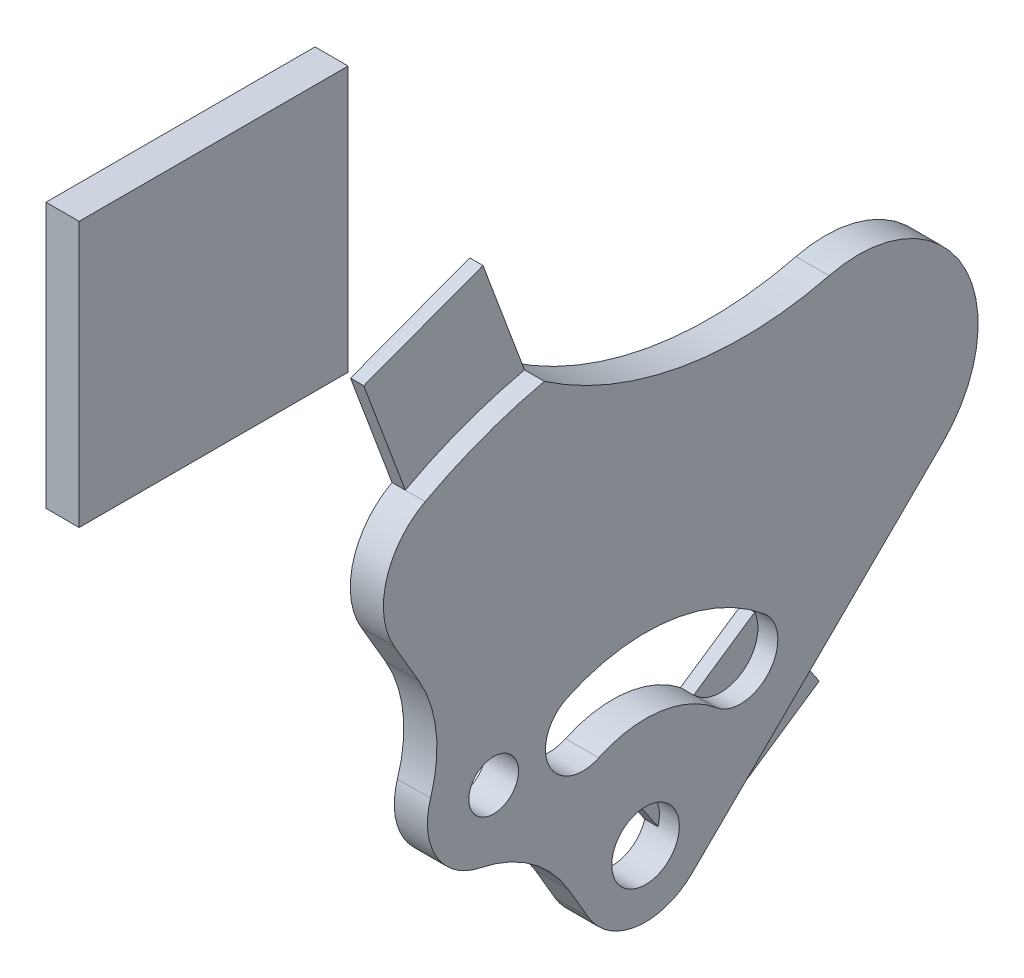
from build123d import *

# Parameters (mm, degrees)
BOSS_EXTRUDE2_DEPTH            = 19.05
SKETCH9_R                      = 3.2385
SKETCH9_R_2                    = 3.175
CUT_EXTRUDE4_DEPTH             = 153.631238014
CUT_EXTRUDE7_DEPTH             = 52.07
SKETCH16_W                     = 6.35
SKETCH16_H                     = 9.525
BOSS_EXTRUDE3_DEPTH            = 52.07
BOSS_EXTRUDE5_DEPTH            = 38.1
CUT_EXTRUDE10_DEPTH            = 153.631238014
SKETCH22_R                     = 3.175
CUT_EXTRUDE11_DEPTH            = 535.426844636
CUT_EXTRUDE13_DEPTH            = 3.175
CUT_EXTRUDE13_DEPTH_BACK       = 5.08
SKETCH27_R                     = 6.35
SKETCH28_W                     = 12.7
SKETCH28_H                     = 6.35
CUT_EXTRUDE14_DEPTH            = 6.35
CUT_EXTRUDE18_DEPTH            = 25.4
CUT_EXTRUDE23_REACH            = 116.123
SKETCH48_W                     = 4.7625
SKETCH48_H                     = 46.015558287
BOSS_EXTRUDE6_DEPTH            = 2.38125
BOSS_EXTRUDE9_START            = 6.35
SKETCH41_R                     = 1.651
BOSS_EXTRUDE9_DEPTH            = 3.175
SKETCH44_W                     = 2.15265
SKETCH44_H                     = 21.43125
F_8_CLEARANCE_HOLE1_AT_2_COUNT = 2
F_8_CLEARANCE_HOLE1_AT_2_PITCH = 14.1097
SKETCH54_R                     = 3.2385
CUT_EXTRUDE29_DEPTH            = 534.965103431
BOSS_EXTRUDE17_DEPTH           = 3.175
SKETCH47_R                     = 2.38125
CUT_EXTRUDE22_DEPTH            = 534.965103431
FILLET10_R                     = 12.7
FILLET11_R                     = 7.62
BOSS_EXTRUDE10_DEPTH           = 4.7625
SKETCH57_R                     = 3.175
CUT_EXTRUDE31_DEPTH            = 534.497648303
SKETCH58_R                     = 3.175
CUT_EXTRUDE32_DEPTH            = 534.497648303
BOSS_EXTRUDE12_DEPTH           = 4.7625
FILLET4_R                      = 161.925
CUT_EXTRUDE33_DEPTH            = 534.497648303
SKETCH63_W                     = 2.45745
SKETCH63_H                     = 21.43125
FILLET6_R                      = 1.27
FILLET7_R                      = 2
FILLET9_R                      = 12.7
FILLET8_R                      = 6.35
BOSS_EXTRUDE15_DEPTH           = 1.27
SKETCH67_W                     = 25.783881398
SKETCH67_H                     = 25.415540234
BOSS_EXTRUDE16_DEPTH           = 3.175


with BuildPart() as part:
    # Sketch4 → Boss-Extrude2 (new, symmetric)
    with BuildSketch(Plane(origin=(0, 0, 0), x_dir=(0, 0, -1), z_dir=(1, 0, 0))):
        with BuildLine():
            Line((-186.846778023, 405.26156603), (-158.205357675, 369.030625673))
            Line((-158.205357675, 369.030625673), (-140.256718713, 375.414109002))
            Line((-140.256718713, 375.414109002), (-157.704906478, 424.473722165))
            Line((-157.704906478, 424.473722165), (-175.65354544, 418.090238836))
            Line((-175.65354544, 418.090238836), (-177.355807661, 422.876542559))
            ThreePointArc((-177.355807661, 422.876542559), (-243.191724351, 450.45722133), (-264.474202715, 382.324131846))
            Line((-264.474202715, 382.324131846), (-237.676042854, 336.546390968))
            ThreePointArc((-237.676042854, 336.546390968), (-229.492825478, 334.008496997), (-226.23061556, 341.930866521))
            Line((-226.23061556, 341.930866521), (-246.687133952, 397.9992122))
            ThreePointArc((-246.687133952, 397.9992122), (-243.637808701, 421.265815224), (-222.825693032, 432.10505146))
            ThreePointArc((-222.825693032, 432.10505146), (-209.542420342, 429.05833538), (-198.914683118, 420.527273681))
            Line((-198.914683118, 420.527273681), (-186.846778023, 405.26156603))
        make_face()
    extrude(amount=BOSS_EXTRUDE2_DEPTH, both=True)

    # Sketch9 → Cut-Extrude4 (cut, through all)
    with BuildSketch(Plane(origin=(0, 426.601549941, 151.722026824), x_dir=(1, 0, 0), z_dir=(0, 0.9421857722885012, 0.33509098838542445))):
        with Locations(Location((6.35, -19.05, 0), (0, 0, 270))):
            Circle(SKETCH9_R)
        with Locations((-9.525, -6.35)):
            Circle(SKETCH9_R_2)
        with Locations((9.525, -6.35)):
            Circle(SKETCH9_R_2)
    extrude(amount=-CUT_EXTRUDE4_DEPTH, mode=Mode.SUBTRACT)

    # Sketch15 → Cut-Extrude7 (cut)
    with BuildSketch(Plane(origin=(0, 426.601549941, 151.722026824), x_dir=(1, 0, 0), z_dir=(0, 0.9421857722885011, 0.33509098838542445))):
        Polygon((-3.175, -9.525), (6.35, -9.525), (9.525, -9.525), (9.525, -6.35), (-9.525, -6.35), (-9.525, -9.525), align=None)
    extrude(amount=-CUT_EXTRUDE7_DEPTH, mode=Mode.SUBTRACT)

    # Sketch16 → Boss-Extrude3 (add)
    with BuildSketch(Plane(origin=(0, 426.601549941, 151.722026824), x_dir=(1, 0, 0), z_dir=(0, 0.9421857722885012, 0.3350909883854245))):
        with Locations((15.875, -1.5875)):
            Rectangle(SKETCH16_W, SKETCH16_H)
        with Locations((-15.875, -1.5875)):
            Rectangle(SKETCH16_W, SKETCH16_H)
    extrude(amount=-BOSS_EXTRUDE3_DEPTH)

    # Sketch20 → Boss-Extrude5 (add)
    with BuildSketch(Plane(origin=(19.05, 0, 0), x_dir=(0, 0, -1), z_dir=(1, 0, 0))):
        with BuildLine():
            Line((-148.730586997, 427.665463829), (-175.65354544, 418.090238836))
            Line((-175.65354544, 418.090238836), (-177.355807661, 422.876542559))
            ThreePointArc((-177.355807661, 422.876542559), (-196.734821197, 447.304238729), (-227.005535657, 454.78370073))
            Line((-227.005535657, 454.78370073), (-160.433639767, 460.571301927))
            Line((-160.433639767, 460.571301927), (-148.730586997, 427.665463829))
        make_face()
    extrude(amount=-BOSS_EXTRUDE5_DEPTH)

    # Sketch21 → Cut-Extrude10 (cut, through all)
    with BuildSketch(Plane(origin=(0, 426.601549941, 151.722026824), x_dir=(1, 0, 0), z_dir=(0, -0.942185772288501, -0.335090988385425))):
        with BuildLine():
            Line((19.05, 14.478), (19.05, 6.35))
            Line((19.05, 6.35), (19.05, -3.175))
            Line((19.05, -3.175), (-19.05, -3.175))
            Line((-19.05, -3.175), (-19.05, 6.35))
            Line((-19.05, 6.35), (-19.05, 14.478))
            Line((-19.05, 14.478), (-15.97025, 14.478))
            Line((-15.97025, 14.478), (-8.0264, 25.0698))
            ThreePointArc((-8.0264, 25.0698), (0, 29.083), (8.0264, 25.0698))
            Line((8.0264, 25.0698), (15.97025, 14.478))
            Line((15.97025, 14.478), (19.05, 14.478))
        make_face()
    extrude(amount=-CUT_EXTRUDE10_DEPTH, mode=Mode.SUBTRACT)

    # Sketch22 → Cut-Extrude11 (cut, through all)
    with BuildSketch(Plane(origin=(19.05, 0, 0), x_dir=(0, 0, -1), z_dir=(1, 0, 0))):
        with Locations((-253.002053482, 402.413470169)):
            Circle(SKETCH22_R)
        with Locations((-239.490468058, 381.184164458)):
            Circle(SKETCH22_R)
    extrude(amount=-CUT_EXTRUDE11_DEPTH, mode=Mode.SUBTRACT)

    # Sketch27 → Cut-Extrude13 (cut, two sides: drawn at the far end of the back side and taken through both)
    with BuildSketch(Plane(origin=(-17.1704, -4.31523473, 12.133279938), x_dir=(-0.5432430093887411, -0.1572894719134328, -0.8247102853581115), z_dir=(0.7999999999999949, 0.20105459303125733, -0.5653114633731071)).offset(-CUT_EXTRUDE13_DEPTH_BACK)):
        with Locations(Location((-205.469391655, 414.258576717, 0), (0, 0, 168.252215141))):
            Circle(SKETCH27_R)
    extrude(amount=CUT_EXTRUDE13_DEPTH + CUT_EXTRUDE13_DEPTH_BACK, mode=Mode.SUBTRACT)

    # Sketch28 → Cut-Extrude14 (cut)
    with BuildSketch(Plane(origin=(0, -4.85144733, 13.640965611), x_dir=(-1, 0, 0), z_dir=(-1.200145339583648e-13, 0.33509098838542495, -0.942185772288501))):
        with Locations((-12.7, 481.353594719)):
            Rectangle(SKETCH28_W, SKETCH28_H)
    extrude(amount=-CUT_EXTRUDE14_DEPTH, mode=Mode.SUBTRACT)

    # Sketch33 → Cut-Extrude18 (cut, symmetric)
    with BuildSketch(Plane(origin=(0, 0, 0), x_dir=(0, 0, -1), z_dir=(1, 0, 0))):
        with BuildLine():
            Line((-199.247314558, 457.196933995), (-212.078601064, 429.719395123))
            ThreePointArc((-212.078601064, 429.719395123), (-239.987832709, 425.42992694), (-246.687133952, 397.9992122))
            Line((-246.687133952, 397.9992122), (-226.23061556, 341.930866521))
            ThreePointArc((-226.23061556, 341.930866521), (-229.492825478, 334.008496997), (-237.676042854, 336.546390968))
            Line((-237.676042854, 336.546390968), (-264.474202715, 382.324131846))
            ThreePointArc((-264.474202715, 382.324131846), (-265.693591855, 428.871937811), (-227.005535657, 454.78370073))
            Line((-227.005535657, 454.78370073), (-199.247314558, 457.196933995))
        make_face()
    extrude(amount=CUT_EXTRUDE18_DEPTH, both=True, mode=Mode.SUBTRACT)

    # Cut-Extrude23: up to this plane
    cut_extrude23_end = Plane(origin=(-108.1095773, 454.78370073, 227.005535657), z_dir=(0, 0.9962422144646194, 0.08661091223761264))
    # Sketch48 → Cut-Extrude23 (cut, up to the surface)
    with BuildSketch(Plane(origin=(0, 377.541936778, 134.273839059), x_dir=(1, 0, 0), z_dir=(0, -0.9421857722885012, -0.3350909883854244)), mode=Mode.PRIVATE) as cut_extrude23_sk1:
        with Locations((0, 32.532779144)):
            Rectangle(SKETCH48_W, SKETCH48_H)
    cut_extrude23_tool1 = split(extrude(cut_extrude23_sk1.sketch, amount=-CUT_EXTRUDE23_REACH, mode=Mode.PRIVATE), bisect_by=cut_extrude23_end, keep=Keep.BOTH, mode=Mode.PRIVATE)
    add(cut_extrude23_tool1.solids().sort_by_distance((0, 366.640496, 164.925761))[0], mode=Mode.SUBTRACT)


with BuildPart() as cut_extrude23_piece_1:
    # of the separate pieces the step leaves, piece 1, a body of its own (cut_extrude23_pieces)
    add(part.part.solids().sort_by_distance((-19.05, 457.196933995, 199.247314558))[0])


with BuildPart() as cut_extrude23_piece_2:
    # of the separate pieces the step leaves, piece 2, a body of its own (cut_extrude23_pieces)
    add(part.part.solids().sort_by_distance((19.05, 457.196933995, 199.247314558))[0])


with BuildPart() as body_3:
    # Sketch35 → Boss-Extrude6 (new, symmetric)
    with BuildSketch(Plane(origin=(0, 0, 0), x_dir=(0, 0, -1), z_dir=(1, 0, 0))):
        with BuildLine():
            Line((-237.676042854, 336.546390968), (-264.474202715, 382.324131846))
            ThreePointArc((-264.474202715, 382.324131846), (-265.472121099, 429.295088492), (-226.053156197, 454.857009691))
            Line((-226.053156197, 454.857009691), (-204.645177824, 456.727656689))
            Line((-204.645177824, 456.727656689), (-195.764245071, 457.499743714))
            Line((-195.764245071, 457.499743714), (-187.436501805, 446.96528118))
            Line((-187.436501805, 446.96528118), (-172.228614898, 427.727546572))
            Line((-172.228614898, 427.727546572), (-189.069775711, 408.073622684))
            Line((-189.069775711, 408.073622684), (-198.914683118, 420.527273681))
            ThreePointArc((-198.914683118, 420.527273681), (-209.542420342, 429.05833538), (-222.825693032, 432.10505146))
            ThreePointArc((-222.825693032, 432.10505146), (-243.637808701, 421.265815224), (-246.687133952, 397.9992122))
            Line((-246.687133952, 397.9992122), (-226.23061556, 341.930866521))
            ThreePointArc((-226.23061556, 341.930866521), (-229.492825478, 334.008496997), (-237.676042854, 336.546390968))
        make_face()
    extrude(amount=BOSS_EXTRUDE6_DEPTH, both=True)

    # Sketch44 → #8 Clearance Hole1 (revolve, cut)
    with BuildSketch(Plane(origin=(2.38125, 352.520342369, 238.205511608), x_dir=(0, 0, -1), z_dir=(0, 1, 0))):
        with Locations((1.076325, 10.715625)):
            Rectangle(SKETCH44_W, SKETCH44_H)
    f_8_clearance_hole1 = revolve(axis=Axis((8.73125, 352.520342369, 238.205511608), (-1, 0, 0)), mode=Mode.SUBTRACT)

    # #8 Clearance Hole1 at 2: #8 Clearance Hole1 ×2
    with Locations(*[Vector(0, -0.9047630823191329, -0.42591520854787757) * (i * F_8_CLEARANCE_HOLE1_AT_2_PITCH) for i in range(1, F_8_CLEARANCE_HOLE1_AT_2_COUNT)]):
        add(f_8_clearance_hole1, mode=Mode.SUBTRACT)

    # Sketch56 → Boss-Extrude10 (add)
    with BuildSketch(Plane.ZY.offset(2.38125)):
        Polygon((172.228614898, 427.727546572), (189.069775711, 408.073622684), (150.093881412, 374.128883937), (137.640230415, 383.973791344), align=None)
    extrude(amount=-BOSS_EXTRUDE10_DEPTH)

    # Sketch57 → Cut-Extrude31 (cut, through all)
    with BuildSketch(Plane.ZY.offset(2.38125)):
        with Locations((154.366633975, 389.773278837)):
            Circle(SKETCH57_R)
    extrude(amount=-CUT_EXTRUDE31_DEPTH, mode=Mode.SUBTRACT)

    # Sketch58 → Cut-Extrude32 (cut, through all)
    with BuildSketch(Plane(origin=(2.38125, 0, 0), x_dir=(0, 0, -1), z_dir=(1, 0, 0))):
        with Locations((-251.088512577, 393.691356506)):
            Circle(SKETCH58_R)
    extrude(amount=-CUT_EXTRUDE32_DEPTH, mode=Mode.SUBTRACT)

    # Sketch60 → Boss-Extrude12 (add)
    with BuildSketch(Plane.ZY.offset(2.38125)):
        with BuildLine():
            Line((238.16133602, 337.577946891), (232.720186483, 322.664546316))
            ThreePointArc((232.720186483, 322.664546316), (224.578366438, 318.875645901), (220.789466023, 327.017465946))
            Line((220.789466023, 327.017465946), (226.23061556, 341.930866521))
            ThreePointArc((226.23061556, 341.930866521), (230.019515975, 333.789046476), (238.16133602, 337.577946891))
        make_face()
    extrude(amount=-BOSS_EXTRUDE12_DEPTH)

    # Fillet4
    fillet4_edges = [body_3.edges().sort_by_distance(p)[0] for p in [
        (0, 337.040299626, 237.965175583),
    ]]
    fillet(fillet4_edges, radius=FILLET4_R)

    # Sketch61 → Cut-Extrude33 (cut, through all)
    with BuildSketch(Plane.ZY.offset(2.38125)):
        with BuildLine():
            Line((157.330045228, 408.881093338), (149.454119303, 398.91817254))
            ThreePointArc((149.454119303, 398.91817254), (151.090857413, 398.367142584), (152.779456246, 398.004955291))
            Line((152.779456246, 398.004955291), (159.820775427, 406.912111857))
            Line((159.820775427, 406.912111857), (157.330045228, 408.881093338))
        make_face()
    extrude(amount=-CUT_EXTRUDE33_DEPTH, mode=Mode.SUBTRACT)


with BuildPart() as body_4:
    # Sketch41 → Boss-Extrude9 (new body)
    with BuildSketch(Plane(origin=(2.38125, 0, 0), x_dir=(0, 0, -1), z_dir=(1, 0, 0)).offset(BOSS_EXTRUDE9_START)):
        with BuildLine():
            Line((-259.901827857, 374.513409299), (-237.676042854, 336.546390968))
            ThreePointArc((-237.676042854, 336.546390968), (-233.025285674, 333.458793542), (-227.733605481, 335.23669144))
            Line((-227.733605481, 335.23669144), (-203.734295846, 358.941993885))
            ThreePointArc((-203.734295846, 358.941993885), (-201.795644606, 372.748442455), (-214.603143546, 378.257014105))
            ThreePointArc((-214.603143546, 378.257014105), (-228.769887709, 377.768125905), (-241.890035296, 383.134444861))
            ThreePointArc((-241.890035296, 383.134444861), (-251.386309553, 379.848465993), (-259.901827857, 374.513409299))
        make_face()
        with Locations((-232.19597579, 339.754406706)):
            Circle(SKETCH41_R, mode=Mode.SUBTRACT)
        with BuildLine():
            ThreePointArc((-220.782994488, 353.265112137), (-229.890488905, 357.289515308), (-239.728720687, 355.756064675))
            ThreePointArc((-239.728720687, 355.756064675), (-241.441233915, 350.99713329), (-236.682302529, 349.284620062))
            ThreePointArc((-236.682302529, 349.284620062), (-230.822881705, 350.197907406), (-225.39867097, 347.801066971))
            ThreePointArc((-225.39867097, 347.801066971), (-220.358810146, 348.225251313), (-220.782994488, 353.265112137))
        make_face(mode=Mode.SUBTRACT)
    extrude(amount=BOSS_EXTRUDE9_DEPTH)


with BuildPart() as body_5:
    # Mirror1: mirrored copy
    add(body_4.part.mirror(Plane(origin=(0, 0, 0), x_dir=(0, 0, 1), z_dir=(1, 0, 0))))


with BuildPart() as cut_extrude29_tool:
    # Sketch54 → Cut-Extrude29 (new, through all)
    with BuildSketch(Plane.ZY.offset(11.90625)):
        with Locations(Location((232.19597579, 339.754406706, 0), (0, 0, 180))):
            Circle(SKETCH54_R)
    extrude(amount=-CUT_EXTRUDE29_DEPTH)


with BuildPart() as body_5_1:
    add(body_5.part)

    # Cut-Extrude29: cut by cut_extrude29_tool
    add(cut_extrude29_tool.part, mode=Mode.SUBTRACT)


with BuildPart() as body_4_1:
    add(body_4.part)

    # Cut-Extrude29: cut by cut_extrude29_tool
    add(cut_extrude29_tool.part, mode=Mode.SUBTRACT)

    # Sketch68 → Boss-Extrude17 (add)
    with BuildSketch(Plane(origin=(11.90625, 0, 0), x_dir=(0, 0, -1), z_dir=(1, 0, 0))):
        with BuildLine():
            Line((-249.957697324, 357.526428359), (-243.541665847, 346.566294232))
            ThreePointArc((-243.541665847, 346.566294232), (-252.229748649, 348.838345557), (-249.957697324, 357.526428359))
        make_face()
    extrude(amount=-BOSS_EXTRUDE17_DEPTH)


with BuildPart() as cut_extrude22_tool:
    # Sketch47 → Cut-Extrude22 (new, through all)
    with BuildSketch(Plane(origin=(11.90625, 0, 0), x_dir=(0, 0, -1), z_dir=(1, 0, 0))):
        with Locations((-246.749681585, 352.046361295)):
            Circle(SKETCH47_R)
    extrude(amount=-CUT_EXTRUDE22_DEPTH)


with BuildPart() as body_4_2:
    add(body_4_1.part)

    # Cut-Extrude22: cut by cut_extrude22_tool
    add(cut_extrude22_tool.part, mode=Mode.SUBTRACT)

    # Fillet10
    fillet10_edges = [body_4_2.edges().sort_by_distance(p)[0] for p in [
        (10.31875, 346.566294232, 243.541665847),
        (10.31875, 357.526428359, 249.957697324),
    ]]
    fillet(fillet10_edges, radius=FILLET10_R)

    # Fillet11
    fillet11_edges = [body_4_2.edges().sort_by_distance(p)[0] for p in [
        (10.31875, 374.513409299, 259.901827857),
    ]]
    fillet(fillet11_edges, radius=FILLET11_R)

    # Sketch66 → Boss-Extrude15 (add)
    with BuildSketch(Plane.ZY.offset(-8.73125)):
        Polygon((219.676143821, 352.088594489), (232.292980439, 343.540317836), (226.260033989, 334.635985094), (213.643197371, 343.184261748), align=None)
        Polygon((241.890035296, 383.134444861), (253.315956343, 378.866411532), (257.295076427, 389.518885027), (245.86915538, 393.786918357), align=None)
    extrude(amount=-BOSS_EXTRUDE15_DEPTH)


with BuildPart() as body_5_2:
    add(body_5_1.part)

    # Cut-Extrude22: cut by cut_extrude22_tool
    add(cut_extrude22_tool.part, mode=Mode.SUBTRACT)


with BuildPart() as f_10_0_1935_diameter_hole1_tool:
    # Sketch63 → #10 (0.1935) Diameter Hole1 (revolve)
    with BuildSketch(Plane(origin=(-2.38125, 447.807292483, 200.24390249), x_dir=(0, 0, 1), z_dir=(0, 1, 0))):
        with Locations((1.228725, 10.715625)):
            Rectangle(SKETCH63_W, SKETCH63_H)
    revolve(axis=Axis((-8.73125, 447.807292483, 200.24390249), (1, 0, 0)))


with BuildPart() as cut_extrude23_piece_2_1:
    add(cut_extrude23_piece_2.part)

    # #10 (0.1935) Diameter Hole1: cut by f_10_0_1935_diameter_hole1_tool
    add(f_10_0_1935_diameter_hole1_tool.part, mode=Mode.SUBTRACT)


with BuildPart() as body_3_1:
    add(body_3.part)

    # #10 (0.1935) Diameter Hole1: cut by f_10_0_1935_diameter_hole1_tool
    add(f_10_0_1935_diameter_hole1_tool.part, mode=Mode.SUBTRACT)

    # Fillet6
    fillet6_edges = [body_3_1.edges().sort_by_distance(p)[0] for p in [
        (0, 408.881093338, 157.330045228),
    ]]
    fillet(fillet6_edges, radius=FILLET6_R)

    # Fillet7
    fillet7_edges = [body_3_1.edges().sort_by_distance(p)[0] for p in [
        (0, 406.912111857, 159.820775427),
        (0, 398.004955291, 152.779456246),
    ]]
    fillet(fillet7_edges, radius=FILLET7_R)

    # Fillet9
    fillet9_edges = [body_3_1.edges().sort_by_distance(p)[0] for p in [
        (0, 457.499743714, 195.764245071),
    ]]
    fillet(fillet9_edges, radius=FILLET9_R)

    # Fillet8
    fillet8_edges = [body_3_1.edges().sort_by_distance(p)[0] for p in [
        (0, 383.973791344, 137.640230415),
        (0, 374.128883937, 150.093881412),
    ]]
    fillet(fillet8_edges, radius=FILLET8_R)


with BuildPart() as body_2:
    # Sketch67 → Boss-Extrude16 (new body)
    with BuildSketch(Plane.ZY.offset(-8.73125)):
        with Locations((273.586337896, 406.00175714)):
            Rectangle(SKETCH67_W, SKETCH67_H)
    extrude(amount=-BOSS_EXTRUDE16_DEPTH)


solid = Compound([body_4_2.part, body_2.part])
